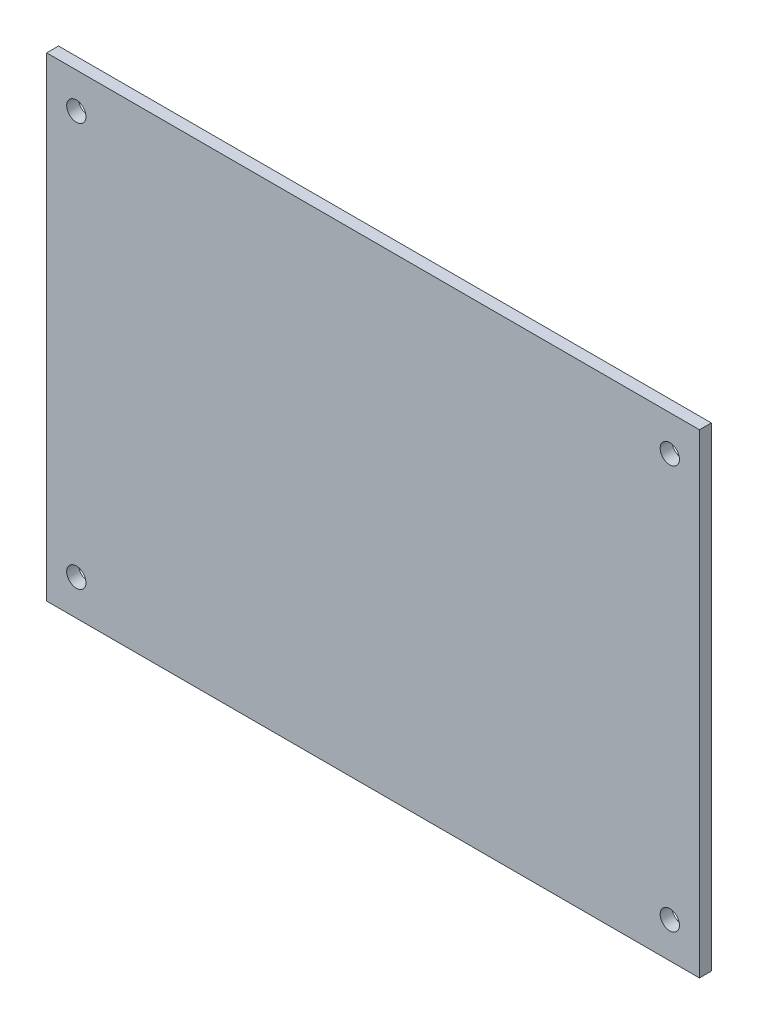
from build123d import *

# Parameters (mm, degrees)
SKETCH1_W           = 110
SKETCH1_H           = 80
BOSS_EXTRUDE1_DEPTH = 2
SKETCH2_R           = 1.624633008
CUT_EXTRUDE1_DEPTH  = 69.036754773


with BuildPart() as part:
    # Sketch1 → Boss-Extrude1 (new body)
    with BuildSketch(Plane.XY):
        Rectangle(SKETCH1_W, SKETCH1_H)
    extrude(amount=-BOSS_EXTRUDE1_DEPTH)

    # Sketch2 → Cut-Extrude1 (cut, through all)
    with BuildSketch(Plane.XY):
        with Locations((-50, 34)):
            Circle(SKETCH2_R)
        with Locations(Location((50, 34, 0), (0, 0, 180))):
            Circle(SKETCH2_R)
        with Locations((50, -34)):
            Circle(SKETCH2_R)
        with Locations(Location((-50, -34, 0), (0, 0, 180))):
            Circle(SKETCH2_R)
    extrude(amount=-CUT_EXTRUDE1_DEPTH, mode=Mode.SUBTRACT)


solid = part.part
